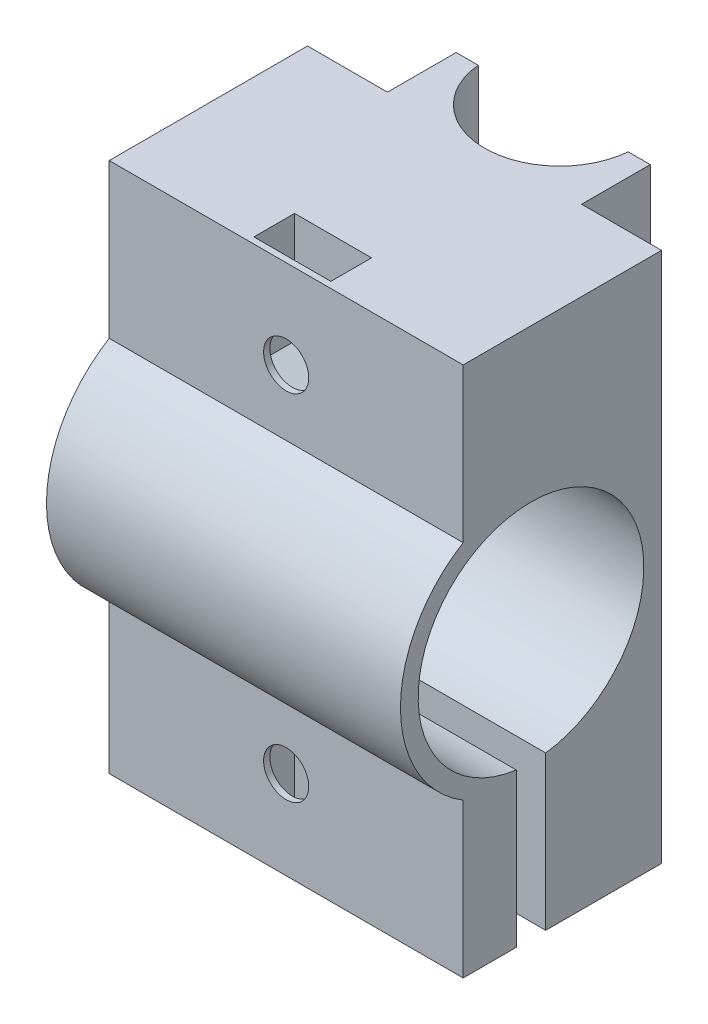
from build123d import *

# Parameters (mm, degrees)
BOSS_EXTRUDE1_DEPTH = 38.1
BOSS_EXTRUDE2_DEPTH = 25.4
CUT_EXTRUDE1_DEPTH  = 2.921
SKETCH5_R           = 3.2385
CUT_EXTRUDE3_DEPTH  = 58.589283942


with BuildPart() as part:
    # Sketch1 → Boss-Extrude1 (new, symmetric)
    with BuildSketch(Plane(origin=(0, 0, 0), x_dir=(1, 0, 0), z_dir=(0, 1, 0))):
        with BuildLine():
            Line((-13.928921766, 0), (13.928921766, 0))
            Line((13.928921766, 0), (13.928921766, 12.394153757))
            Line((13.928921766, 12.394153757), (10.753921766, 12.394153757))
            ThreePointArc((10.753921766, 12.394153757), (0, 2.54), (-10.753921766, 12.394153757))
            Line((-10.753921766, 12.394153757), (-13.928921766, 12.394153757))
            Line((-13.928921766, 12.394153757), (-13.928921766, 0))
        make_face()
    extrude(amount=BOSS_EXTRUDE1_DEPTH, both=True)

    # Sketch2 → Boss-Extrude2 (add, symmetric)
    with BuildSketch(Plane(origin=(0, 0, 0), x_dir=(0, 0, -1), z_dir=(1, 0, 0))):
        with BuildLine():
            Line((-18.306045368, -16.053970918), (-18.306045368, -38.1))
            Line((-18.306045368, -38.1), (-25.926045368, -38.1))
            Line((-25.926045368, -38.1), (-25.926045368, -16.005144511))
            ThreePointArc((-25.926045368, -16.005144511), (-34.925, 0), (-25.926045368, 16.005144511))
            Line((-25.926045368, 16.005144511), (-25.926045368, 38.1))
            Line((-25.926045368, 38.1), (2.54, 38.1))
            Line((2.54, 38.1), (2.54, -38.1))
            Line((2.54, -38.1), (-14.078954632, -38.1))
            Line((-14.078954632, -38.1), (-14.078954632, -16.053970918))
            ThreePointArc((-14.078954632, -16.053970918), (-16.1925, 16.1925), (-18.306045368, -16.053970918))
        make_face()
    extrude(amount=BOSS_EXTRUDE2_DEPTH, both=True)

    # Sketch3 → Cut-Extrude1 (cut, symmetric)
    with BuildSketch(Plane.XY.offset(22.116045368)):
        Polygon((5.5245, -28.589571562), (5.5245, -22.210428438), (0, -19.020856876), (-5.5245, -22.210428438), (-5.5245, -28.589571562), (-5.5245, -38.1), (5.5245, -38.1), align=None)
    cut_extrude1 = extrude(amount=CUT_EXTRUDE1_DEPTH, both=True, mode=Mode.SUBTRACT)

    # Sketch5 → Cut-Extrude3 (cut, symmetric)
    with BuildSketch(Plane.XY):
        with Locations((0, -25.4)):
            Circle(SKETCH5_R)
    cut_extrude3 = extrude(amount=CUT_EXTRUDE3_DEPTH, both=True, mode=Mode.SUBTRACT)

    # Mirror1: Cut-Extrude1, Cut-Extrude3 across plane
    add(cut_extrude1.mirror(Plane.ZX), mode=Mode.SUBTRACT)
    add(cut_extrude3.mirror(Plane.ZX), mode=Mode.SUBTRACT)


solid = part.part
